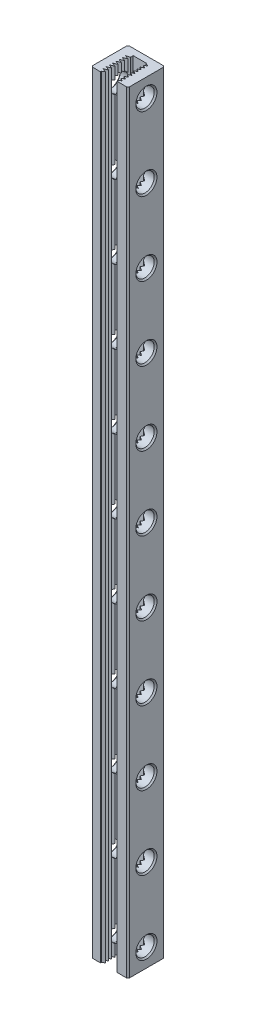
from build123d import *

# Parameters (mm, degrees)
SKETCH1_W                  = 8
SKETCH1_H                  = 8
BOSS_EXTRUDE1_DEPTH        = 300
CUT_EXTRUDE1_DEPTH         = 301.213257535
SKETCH3_R                  = 2
CUT_EXTRUDE2_DEPTH         = 301.213257535
CHAMFER1_SIZE              = 0.3
CHAMFER2_SIZE              = 0.3
LPATTERN1_COUNT            = 19
LPATTERN1_PITCH            = 16
CHAMFER1_OF_LPATTERN1_SIZE = 0.3
SKETCH4_W                  = 8
SKETCH4_H                  = 132
CUT_EXTRUDE3_DEPTH         = 301.213257535


with BuildPart() as part:
    # Sketch1 → Boss-Extrude1 (new body)
    with BuildSketch(Plane(origin=(0, 0, 0), x_dir=(1, 0, 0), z_dir=(0, 1, 0))):
        with Locations((4, 4)):
            Rectangle(SKETCH1_W, SKETCH1_H)
    extrude(amount=BOSS_EXTRUDE1_DEPTH)

    # Sketch2 → Cut-Extrude1 (cut, through all)
    with BuildSketch(Plane.XZ):
        Polygon((5.652029979, 0), (2.008445554, 0), (2.008445554, -0.208206305), (2.54, -0.515099407), (1.673719601, -0.865099407), (2.54, -1.215099407), (1.673719601, -1.572712655), (2.54, -1.915099407), (1.673719601, -2.265099407), (2.54, -2.615099407), (1.673719601, -2.965099407), (2.54, -3.315099407), (1.673719601, -3.665099407), (2.54, -4.015099407), (1.673719601, -4.365099407), (2.54, -4.715099407), (1.673719601, -5.065099407), (2.54, -5.415099407), (1.673719601, -5.765099407), (2.54, -6.026380467), (2.54, -6.6), (5.46, -6.6), (5.46, -6.49878106), (6.106693316, -6.2375), (5.46, -5.8875), (6.106693316, -5.5375), (5.46, -5.1875), (6.106693316, -4.8375), (5.46, -4.4875), (6.106693316, -4.1375), (5.46, -3.7875), (6.106693316, -3.4375), (5.46, -3.0875), (6.106693316, -2.7375), (5.46, -2.3875), (6.106693316, -2.0375), (5.46, -1.6875), (6.106693316, -1.345113247), (5.46, -0.9875), (6.106693316, -0.6375), (5.652029979, -0.375), align=None)
    extrude(amount=-CUT_EXTRUDE1_DEPTH, mode=Mode.SUBTRACT)

    # Sketch3 → Cut-Extrude2 (cut, through all)
    with BuildSketch(Plane(origin=(8, 0, 0), x_dir=(0, 0, -1), z_dir=(1, 0, 0))):
        with Locations((4, 4)):
            Circle(SKETCH3_R)
    cut_extrude2 = extrude(amount=-CUT_EXTRUDE2_DEPTH, mode=Mode.SUBTRACT)

    # Chamfer1
    chamfer1_edges = [part.edges().sort_by_distance(p)[0] for p in [
        (0, 4, -2),
        (8, 4, -2),
    ]]
    chamfer(chamfer1_edges, length=CHAMFER1_SIZE)

    # Chamfer2
    chamfer2_edges = [part.edges().sort_by_distance(p)[0] for p in [
        (0, 150, -8),
        (8, 150, -8),
        (8, 150, 0),
        (0, 150, 0),
    ]]
    chamfer(chamfer2_edges, length=CHAMFER2_SIZE)

    # LPattern1: Cut-Extrude2 ×19
    with Locations(*[(0, i * LPATTERN1_PITCH, 0) for i in range(1, LPATTERN1_COUNT)]):
        add(cut_extrude2, mode=Mode.SUBTRACT)

    # Chamfer1 of LPattern1
    chamfer1_of_lpattern1_edges = [part.edges().sort_by_distance(p)[0] for p in [
        (0, 20, -2),
        (8, 20, -2),
        (0, 36, -2),
        (8, 36, -2),
        (0, 52, -2),
        (8, 52, -2),
        (0, 68, -2),
        (8, 68, -2),
        (0, 84, -2),
        (8, 84, -2),
        (0, 100, -2),
        (8, 100, -2),
        (0, 116, -2),
        (8, 116, -2),
        (0, 132, -2),
        (8, 132, -2),
        (0, 148, -2),
        (8, 148, -2),
        (0, 164, -2),
        (8, 164, -2),
        (0, 180, -2),
        (8, 180, -2),
        (0, 196, -2),
        (8, 196, -2),
        (0, 212, -2),
        (8, 212, -2),
        (0, 228, -2),
        (8, 228, -2),
        (0, 244, -2),
        (8, 244, -2),
        (0, 260, -2),
        (8, 260, -2),
        (0, 276, -2),
        (8, 276, -2),
        (0, 292, -2),
        (8, 292, -2),
    ]]
    chamfer(chamfer1_of_lpattern1_edges, length=CHAMFER1_OF_LPATTERN1_SIZE)

    # Sketch4 → Cut-Extrude3 (cut, through all)
    with BuildSketch(Plane(origin=(8, 0, 0), x_dir=(0, 0, -1), z_dir=(1, 0, 0))):
        with Locations((4, 234)):
            Rectangle(SKETCH4_W, SKETCH4_H)
    extrude(amount=-CUT_EXTRUDE3_DEPTH, mode=Mode.SUBTRACT)


solid = part.part
